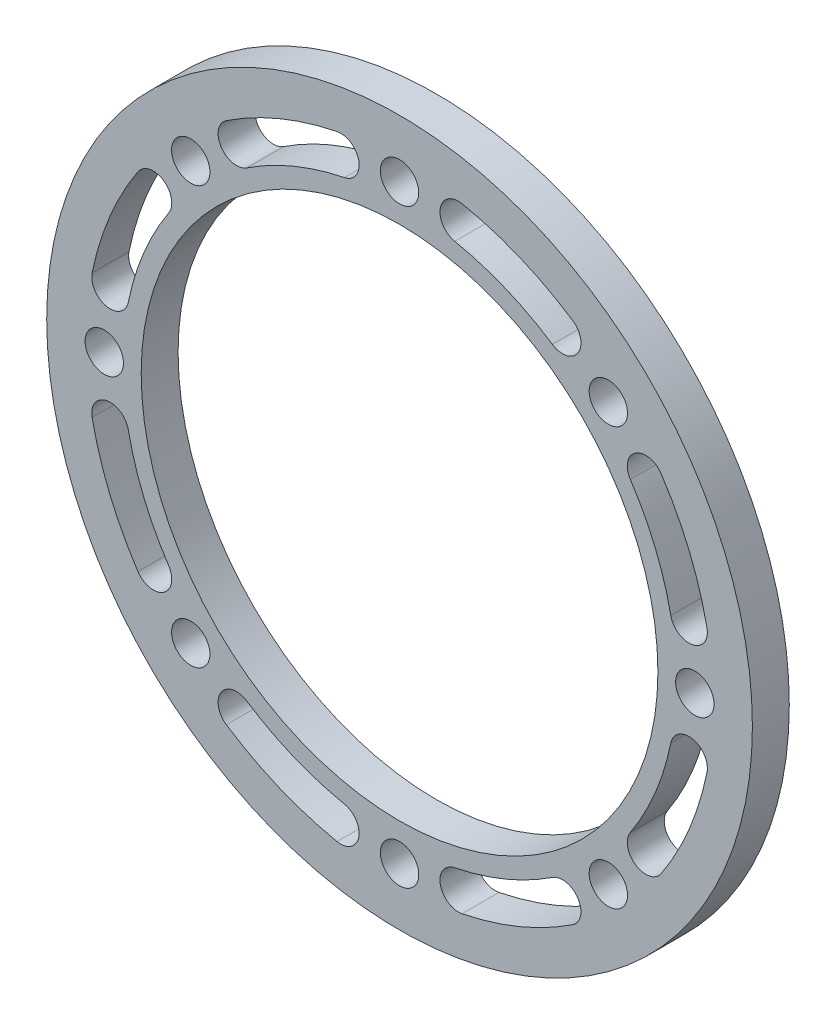
from build123d import *

# Parameters (mm, degrees)
SKETCH_1_R          = 45
SKETCH_1_R_2        = 2.6
SKETCH_1_R_3        = 35
EXTRUDE_2_DEPTH     = 5
EXTRUDE_START       = -5
SKETCH_3_R          = 47.8
SKETCH_3_R_2        = 45
EXTRUDE_3_DEPTH     = 5
CUT_EXTRUDE_1_DEPTH = 10


with BuildPart() as part:
    # 草图1 → 凸台-拉伸2 (new body)
    with BuildSketch(Plane.XY):
        Circle(SKETCH_1_R)
        with Locations((0, 40)):
            Circle(SKETCH_1_R_2, mode=Mode.SUBTRACT)
        with Locations((28.284271247, 28.284271247)):
            Circle(SKETCH_1_R_2, mode=Mode.SUBTRACT)
        with Locations((40, 0)):
            Circle(SKETCH_1_R_2, mode=Mode.SUBTRACT)
        with Locations((28.284271247, -28.284271247)):
            Circle(SKETCH_1_R_2, mode=Mode.SUBTRACT)
        with Locations((0, -40)):
            Circle(SKETCH_1_R_2, mode=Mode.SUBTRACT)
        with Locations((-28.284271247, -28.284271247)):
            Circle(SKETCH_1_R_2, mode=Mode.SUBTRACT)
        Circle(SKETCH_1_R_3, mode=Mode.SUBTRACT)
        with Locations((-40, 0)):
            Circle(SKETCH_1_R_2, mode=Mode.SUBTRACT)
        with Locations((-28.284271247, 28.284271247)):
            Circle(SKETCH_1_R_2, mode=Mode.SUBTRACT)
    extrude(amount=EXTRUDE_2_DEPTH)

    # 草图3 → 凸台-拉伸3 (add)
    with BuildSketch(Plane.XY.offset(5).offset(EXTRUDE_START)):
        Circle(SKETCH_3_R)
        Circle(SKETCH_3_R_2, mode=Mode.SUBTRACT)
    extrude(amount=EXTRUDE_3_DEPTH)

    # 草图4 → 切除-拉伸1 (cut)
    with BuildSketch(Plane.XY.offset(5)):
        with BuildLine():
            ThreePointArc((-8.473137213, 41.646799946), (-16.264045876, 39.264880132), (-23.457321876, 35.440147438))
            ThreePointArc((-23.457321876, 35.440147438), (-24.162193968, 31.975590419), (-20.697636949, 31.270718328))
            ThreePointArc((-20.697636949, 31.270718328), (-14.350628714, 34.645482469), (-7.476297541, 36.747176423))
            ThreePointArc((-7.476297541, 36.747176423), (-5.524905615, 39.695408021), (-8.473137213, 41.646799946))
        make_face()
        with BuildLine():
            ThreePointArc((23.457321876, 35.440147438), (16.264045876, 39.264880132), (8.473137213, 41.646799946))
            ThreePointArc((8.473137213, 41.646799946), (5.524905615, 39.695408021), (7.476297541, 36.747176423))
            ThreePointArc((7.476297541, 36.747176423), (14.350628714, 34.645482469), (20.697636949, 31.270718328))
            ThreePointArc((20.697636949, 31.270718328), (24.162193968, 31.975590419), (23.457321876, 35.440147438))
        make_face()
        with BuildLine():
            ThreePointArc((41.646799946, 8.473137213), (39.264880132, 16.264045876), (35.440147438, 23.457321876))
            ThreePointArc((35.440147438, 23.457321876), (31.975590419, 24.162193968), (31.270718328, 20.697636949))
            ThreePointArc((31.270718328, 20.697636949), (34.645482469, 14.350628714), (36.747176423, 7.476297541))
            ThreePointArc((36.747176423, 7.476297541), (39.695408021, 5.524905615), (41.646799946, 8.473137213))
        make_face()
        with BuildLine():
            ThreePointArc((35.440147438, -23.457321876), (39.264880132, -16.264045876), (41.646799946, -8.473137213))
            ThreePointArc((41.646799946, -8.473137213), (39.695408021, -5.524905615), (36.747176423, -7.476297541))
            ThreePointArc((36.747176423, -7.476297541), (34.645482469, -14.350628714), (31.270718328, -20.697636949))
            ThreePointArc((31.270718328, -20.697636949), (31.975590419, -24.162193968), (35.440147438, -23.457321876))
        make_face()
        with BuildLine():
            ThreePointArc((8.473137213, -41.646799946), (16.264045876, -39.264880132), (23.457321876, -35.440147438))
            ThreePointArc((23.457321876, -35.440147438), (24.162193968, -31.975590419), (20.697636949, -31.270718328))
            ThreePointArc((20.697636949, -31.270718328), (14.350628714, -34.645482469), (7.476297541, -36.747176423))
            ThreePointArc((7.476297541, -36.747176423), (5.524905615, -39.695408021), (8.473137213, -41.646799946))
        make_face()
        with BuildLine():
            ThreePointArc((-23.457321876, -35.440147438), (-16.264045876, -39.264880132), (-8.473137213, -41.646799946))
            ThreePointArc((-8.473137213, -41.646799946), (-5.524905615, -39.695408021), (-7.476297541, -36.747176423))
            ThreePointArc((-7.476297541, -36.747176423), (-14.350628714, -34.645482469), (-20.697636949, -31.270718328))
            ThreePointArc((-20.697636949, -31.270718328), (-24.162193968, -31.975590419), (-23.457321876, -35.440147438))
        make_face()
        with BuildLine():
            ThreePointArc((-41.646799946, -8.473137213), (-39.264880132, -16.264045876), (-35.440147438, -23.457321876))
            ThreePointArc((-35.440147438, -23.457321876), (-31.975590419, -24.162193968), (-31.270718328, -20.697636949))
            ThreePointArc((-31.270718328, -20.697636949), (-34.645482469, -14.350628714), (-36.747176423, -7.476297541))
            ThreePointArc((-36.747176423, -7.476297541), (-39.695408021, -5.524905615), (-41.646799946, -8.473137213))
        make_face()
        with BuildLine():
            ThreePointArc((-35.440147438, 23.457321876), (-39.264880132, 16.264045876), (-41.646799946, 8.473137213))
            ThreePointArc((-41.646799946, 8.473137213), (-39.695408021, 5.524905615), (-36.747176423, 7.476297541))
            ThreePointArc((-36.747176423, 7.476297541), (-34.645482469, 14.350628714), (-31.270718328, 20.697636949))
            ThreePointArc((-31.270718328, 20.697636949), (-31.975590419, 24.162193968), (-35.440147438, 23.457321876))
        make_face()
    extrude(amount=-CUT_EXTRUDE_1_DEPTH, mode=Mode.SUBTRACT)


solid = part.part
